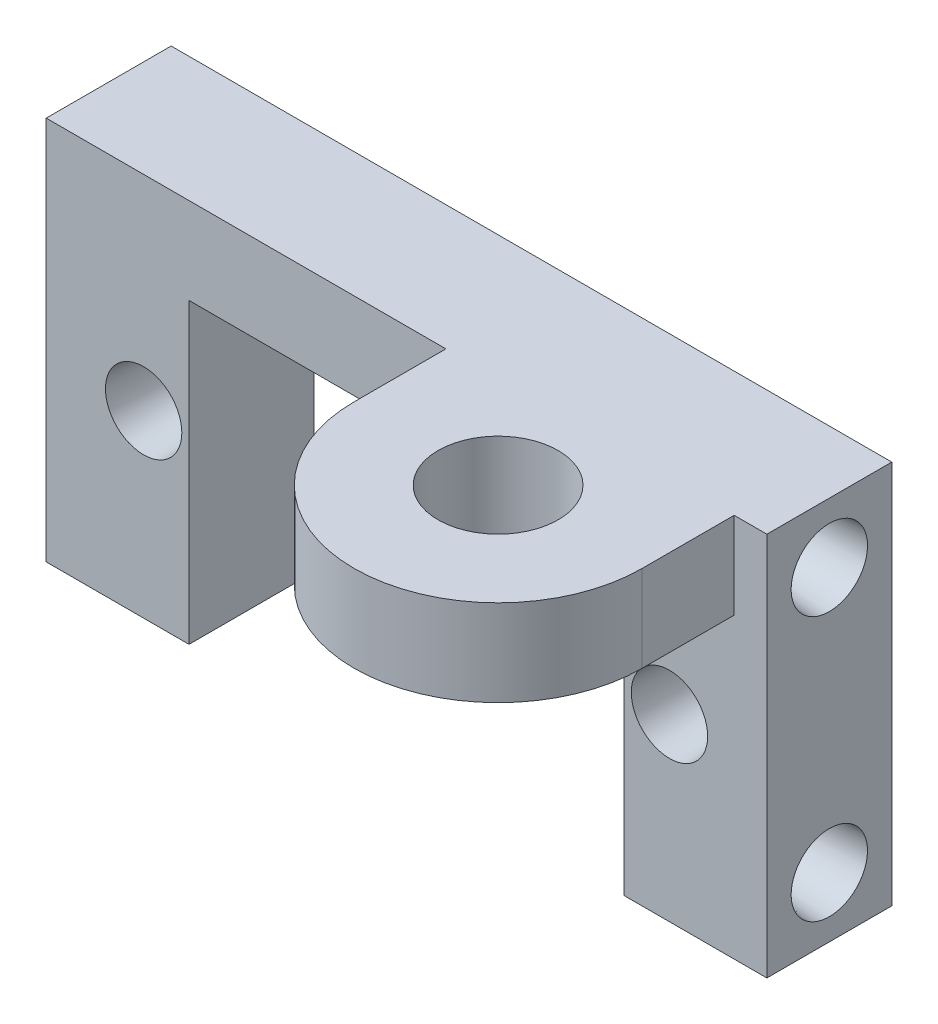
from build123d import *

# Parameters (mm, degrees)
BOSS_EXTRUDE1_DEPTH          = 6.604
SKETCH2_R                    = 3.175
BOSS_EXTRUDE2_DEPTH          = 4.572
SKETCH3_R                    = 1.7907
CUT_EXTRUDE1_DEPTH           = 30.055416707
SKETCH4_R                    = 2.0193
CUT_EXTRUDE2_DEPTH           = 26.214451888
CUT_EXTRUDE2_DRAFT           = -4
CUT_EXTRUDE2_PROFILE_2_DEPTH = 26.214451888
CUT_EXTRUDE2_PROFILE_2_DRAFT = -4
SKETCH5_R                    = 1.7907
CUT_EXTRUDE3_DEPTH           = 6.604
SKETCH6_R                    = 2.0193
CUT_EXTRUDE4_DEPTH           = 6.604
CUT_EXTRUDE4_DRAFT           = -4
CUT_EXTRUDE4_PROFILE_2_DEPTH = 6.604
CUT_EXTRUDE4_PROFILE_2_DRAFT = -4


with BuildPart() as part:
    # Sketch1 → Boss-Extrude1 (new body)
    with BuildSketch(Plane.XY):
        Polygon((-11.5, -6.25), (-11.5, 6.25), (11.5, 6.25), (11.5, -6.25), (11.5, -9.498), (19.05, -9.498), (19.05, -6.25), (19.05, 10.822), (-19.05, 10.822), (-19.05, -6.25), (-19.05, -9.498), (-11.5, -9.498), align=None)
    extrude(amount=BOSS_EXTRUDE1_DEPTH)

    # Sketch2 → Boss-Extrude2 (add)
    with BuildSketch(Plane(origin=(0, 10.822, 0), x_dir=(1, 0, 0), z_dir=(0, 1, 0))):
        with BuildLine():
            Line((2.08, -11.464), (2.08, -6.604))
            Line((2.08, -6.604), (17.32, -6.604))
            Line((17.32, -6.604), (17.32, -11.464))
            ThreePointArc((17.32, -11.464), (9.7, -19.084), (2.08, -11.464))
        make_face()
        with Locations(Location((9.7, -11.464, 0), (0, 0, 180))):
            Circle(SKETCH2_R, mode=Mode.SUBTRACT)
    extrude(amount=-BOSS_EXTRUDE2_DEPTH)

    # Sketch3 → Cut-Extrude1 (cut, through all)
    with BuildSketch(Plane(origin=(0, 0, 0), x_dir=(-1, 0, 0), z_dir=(0, 0, -1))):
        with Locations((13.9, 0)):
            Circle(SKETCH3_R)
        with Locations((-13.9, 0)):
            Circle(SKETCH3_R)
    extrude(amount=-CUT_EXTRUDE1_DEPTH, mode=Mode.SUBTRACT)


with BuildPart() as cut_extrude2_tool:
    # Sketch4 → Cut-Extrude2 (with draft: the straight prism first)
    with BuildSketch(Plane.XY.offset(6.604)):
        with Locations((-13.9, 0)):
            Circle(SKETCH4_R)
    extrude(amount=-CUT_EXTRUDE2_DEPTH)
    # Cut-Extrude2: the draft: its side faces are tilted about the plane it starts from
    cut_extrude2_sides = [cut_extrude2_tool.faces().sort_by_distance(p)[0] for p in [
        (-15.9193, 0, -6.503225944),
    ]]
    draft(cut_extrude2_sides, Plane.XY.offset(6.604), CUT_EXTRUDE2_DRAFT)


with BuildPart() as part_1:
    add(part.part)

    # Cut-Extrude2: cut by cut_extrude2_tool
    add(cut_extrude2_tool.part, mode=Mode.SUBTRACT)


with BuildPart() as cut_extrude2_profile_2_tool:
    # Sketch4 → Cut-Extrude2 profile 2 (with draft: the straight prism first)
    with BuildSketch(Plane.XY.offset(6.604)):
        with Locations((13.9, 0)):
            Circle(SKETCH4_R)
    extrude(amount=-CUT_EXTRUDE2_PROFILE_2_DEPTH)
    # Cut-Extrude2 profile 2: the draft: its side faces are tilted about the plane it starts from
    cut_extrude2_profile_2_sides = [cut_extrude2_profile_2_tool.faces().sort_by_distance(p)[0] for p in [
        (11.8807, 0, -6.503225944),
    ]]
    draft(cut_extrude2_profile_2_sides, Plane.XY.offset(6.604), CUT_EXTRUDE2_PROFILE_2_DRAFT)


with BuildPart() as part_2:
    add(part_1.part)

    # Cut-Extrude2 profile 2: cut by cut_extrude2_profile_2_tool
    add(cut_extrude2_profile_2_tool.part, mode=Mode.SUBTRACT)

    # Sketch5 → Cut-Extrude3 (cut)
    with BuildSketch(Plane(origin=(19.05, 0, 0), x_dir=(0, 0, -1), z_dir=(1, 0, 0))):
        with Locations(Location((-3.302, 7.647, 0), (0, 0, 90))):
            Circle(SKETCH5_R)
        with Locations(Location((-3.302, -6.323, 0), (0, 0, 90))):
            Circle(SKETCH5_R)
    extrude(amount=-CUT_EXTRUDE3_DEPTH, mode=Mode.SUBTRACT)


with BuildPart() as cut_extrude4_tool:
    # Sketch6 → Cut-Extrude4 (with draft: the straight prism first)
    with BuildSketch(Plane(origin=(19.05, 0, 0), x_dir=(0, 0, -1), z_dir=(1, 0, 0))):
        with Locations((-3.302, 7.647)):
            Circle(SKETCH6_R)
    extrude(amount=-CUT_EXTRUDE4_DEPTH)
    # Cut-Extrude4: the draft: its side faces are tilted about the plane it starts from
    cut_extrude4_sides = [cut_extrude4_tool.faces().sort_by_distance(p)[0] for p in [
        (15.748, 7.647, 5.3213),
    ]]
    draft(cut_extrude4_sides, Plane(origin=(19.05, 0, 0), x_dir=(0, 0, -1), z_dir=(1, 0, 0)), CUT_EXTRUDE4_DRAFT)


with BuildPart() as part_3:
    add(part_2.part)

    # Cut-Extrude4: cut by cut_extrude4_tool
    add(cut_extrude4_tool.part, mode=Mode.SUBTRACT)


with BuildPart() as cut_extrude4_profile_2_tool:
    # Sketch6 → Cut-Extrude4 profile 2 (with draft: the straight prism first)
    with BuildSketch(Plane(origin=(19.05, 0, 0), x_dir=(0, 0, -1), z_dir=(1, 0, 0))):
        with Locations((-3.302, -6.323)):
            Circle(SKETCH6_R)
    extrude(amount=-CUT_EXTRUDE4_PROFILE_2_DEPTH)
    # Cut-Extrude4 profile 2: the draft: its side faces are tilted about the plane it starts from
    cut_extrude4_profile_2_sides = [cut_extrude4_profile_2_tool.faces().sort_by_distance(p)[0] for p in [
        (15.748, -6.323, 5.3213),
    ]]
    draft(cut_extrude4_profile_2_sides, Plane(origin=(19.05, 0, 0), x_dir=(0, 0, -1), z_dir=(1, 0, 0)), CUT_EXTRUDE4_PROFILE_2_DRAFT)


with BuildPart() as part_4:
    add(part_3.part)

    # Cut-Extrude4 profile 2: cut by cut_extrude4_profile_2_tool
    add(cut_extrude4_profile_2_tool.part, mode=Mode.SUBTRACT)


solid = part_4.part
